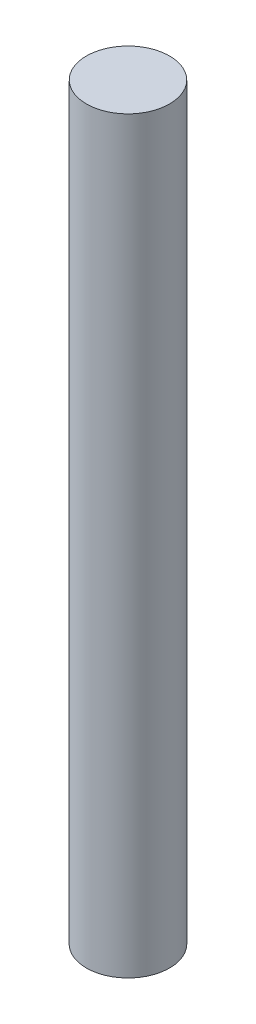
from build123d import *

# Parameters (mm, degrees)
IZIM1_R                     = 25
Y_KSEKLIK_EKSTR_ZYON1_DEPTH = 450


with BuildPart() as part:
    # Çizim1 → Yükseklik-Ekstrüzyon1 (new body)
    with BuildSketch(Plane(origin=(0, 0, 0), x_dir=(1, 0, 0), z_dir=(0, 1, 0))):
        with Locations(Location((0, 0, 0), (0, 0, 270))):
            Circle(IZIM1_R)
    extrude(amount=Y_KSEKLIK_EKSTR_ZYON1_DEPTH)


solid = part.part
